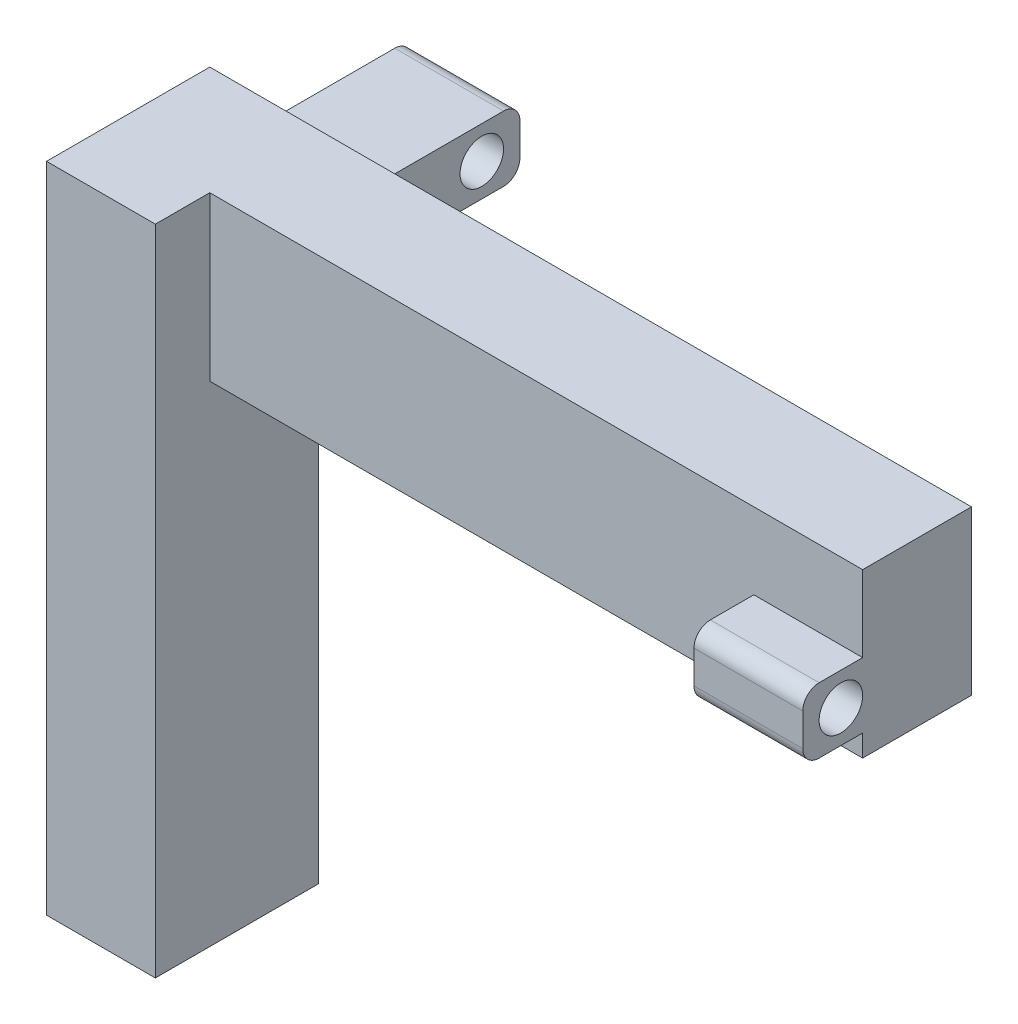
from build123d import *

# Parameters (mm, degrees)
SKETCH1_W           = 10
SKETCH1_H           = 60
BOSS_EXTRUDE1_DEPTH = 15
SKETCH4_W           = 10
SKETCH4_H           = 15
BOSS_EXTRUDE2_DEPTH = 60
BOSS_EXTRUDE4_DEPTH = 10
SKETCH6_R           = 2
CUT_EXTRUDE1_DEPTH  = 10
SKETCH7_R           = 2
BOSS_EXTRUDE6_DEPTH = 10


with BuildPart() as part:
    # Sketch1 → Boss-Extrude1 (new body)
    with BuildSketch(Plane.XY):
        Rectangle(SKETCH1_W, SKETCH1_H)
    extrude(amount=BOSS_EXTRUDE1_DEPTH)

    # Sketch4 → Boss-Extrude2 (add)
    with BuildSketch(Plane(origin=(5, 0, 0), x_dir=(0, 0, -1), z_dir=(1, 0, 0))):
        with Locations((-5, 22.5)):
            Rectangle(SKETCH4_W, SKETCH4_H)
    extrude(amount=BOSS_EXTRUDE2_DEPTH)

    # Sketch5 → Boss-Extrude4 (add)
    # profile 1 of 5: a face of its own
    with BuildSketch(Plane(origin=(65, 0, 0), x_dir=(0, 0, -1), z_dir=(1, 0, 0))):
        with BuildLine():
            Line((-10, 20), (-10, 23))
            Line((-10, 23), (-14, 23))
            ThreePointArc((-14, 23), (-15.060660172, 22.560660172), (-15.5, 21.5))
            Line((-15.5, 21.5), (-15.5, 18.5))
            ThreePointArc((-15.5, 18.5), (-15.060660172, 17.439339828), (-14, 17))
            Line((-14, 17), (-10, 17))
            Line((-10, 17), (-10, 20))
        make_face()
        with BuildLine():
            ThreePointArc((-14, 20), (-12, 22), (-10, 20))
            ThreePointArc((-10, 20), (-12, 18), (-14, 20))
        make_face(mode=Mode.SUBTRACT)
    # profile 2 of 5: a face of its own
    with BuildSketch(Plane(origin=(65, 0, 0), x_dir=(0, 0, -1), z_dir=(1, 0, 0))):
        with BuildLine():
            ThreePointArc((-14, 20), (-12, 18), (-10, 20))
            Line((-10, 20), (-12, 20))
            Line((-12, 20), (-14, 20))
        make_face()
    # profile 3 of 5: a face of its own
    with BuildSketch(Plane(origin=(65, 0, 0), x_dir=(0, 0, -1), z_dir=(1, 0, 0))):
        with BuildLine():
            Line((-12, 20), (-10, 20))
            ThreePointArc((-10, 20), (-12, 22), (-14, 20))
            Line((-14, 20), (-12, 20))
        make_face()
    # profile 4 of 5: a face of its own
    with BuildSketch(Plane(origin=(65, 0, 0), x_dir=(0, 0, -1), z_dir=(1, 0, 0))):
        with BuildLine():
            ThreePointArc((-14, 20), (-12, 18), (-10, 20))
            Line((-10, 20), (-12, 20))
            Line((-12, 20), (-14, 20))
        make_face()
    # profile 5 of 5: a face of its own
    with BuildSketch(Plane(origin=(65, 0, 0), x_dir=(0, 0, -1), z_dir=(1, 0, 0))):
        with BuildLine():
            Line((-12, 20), (-10, 20))
            ThreePointArc((-10, 20), (-12, 22), (-14, 20))
            Line((-14, 20), (-12, 20))
        make_face()
    extrude(amount=-BOSS_EXTRUDE4_DEPTH)

    # Sketch6 → Cut-Extrude1 (cut)
    with BuildSketch(Plane(origin=(65, 0, 0), x_dir=(0, 0, -1), z_dir=(1, 0, 0))):
        with Locations((-12, 20)):
            Circle(SKETCH6_R)
    extrude(amount=-CUT_EXTRUDE1_DEPTH, mode=Mode.SUBTRACT)

    # Sketch7 → Boss-Extrude6 (add)
    with BuildSketch(Plane(origin=(-5, 0, 0), x_dir=(0, 0, -1), z_dir=(1, 0, 0))):
        with BuildLine():
            Line((10, 23), (0, 23))
            Line((0, 23), (0, 17))
            Line((0, 17), (10, 17))
            Line((10, 17), (17, 17))
            ThreePointArc((17, 17), (18.060660172, 17.439339828), (18.5, 18.5))
            Line((18.5, 18.5), (18.5, 21.5))
            ThreePointArc((18.5, 21.5), (18.060660172, 22.560660172), (17, 23))
            Line((17, 23), (10, 23))
        make_face()
        with Locations((15, 20)):
            Circle(SKETCH7_R, mode=Mode.SUBTRACT)
    extrude(amount=BOSS_EXTRUDE6_DEPTH)


solid = part.part
